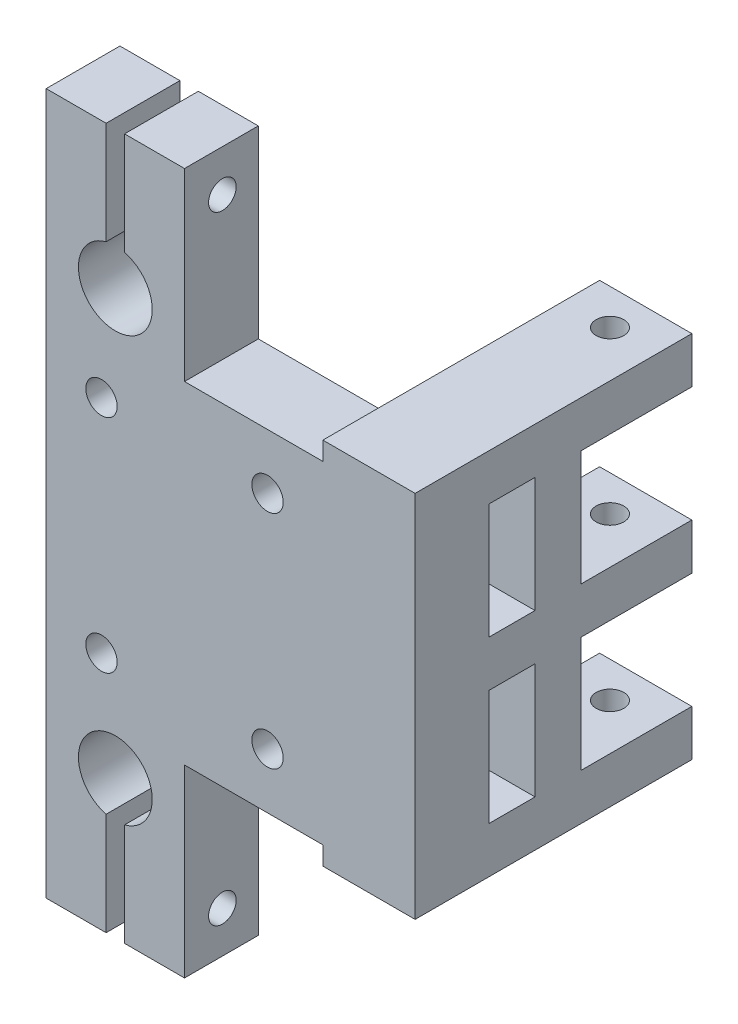
from build123d import *

# Parameters (mm, degrees)
SKETCH_1_W          = 30
SKETCH_1_H          = 36
SKETCH_1_R          = 1.7
EXTRUDE_1_DEPTH     = 8
SKETCH_2_R          = 3.75
CUT_EXTRUDE_1_DEPTH = 4.5
SKETCH_3_W          = 15
SKETCH_3_H          = 20
SKETCH_3_R          = 4
EXTRUDE_4_DEPTH     = 8
SKETCH_8_W          = 10
SKETCH_8_H          = 40
EXTRUDE_5_DEPTH     = 30
SKETCH_10_W         = 12
SKETCH_10_H         = 12.5
SKETCH_10_W_2       = 5
CUT_EXTRUDE_4_DEPTH = 30
SKETCH_11_R         = 1.5
CUT_EXTRUDE_5_DEPTH = 47
SKETCH_12_W         = 2
SKETCH_12_H         = 25.842259392
SKETCH_12_H_2       = 30.756424204
CUT_EXTRUDE_6_DEPTH = 10
SKETCH_13_R         = 1.5
CUT_EXTRUDE_7_DEPTH = 40


with BuildPart() as part:
    # 草图1 → 凸台-拉伸1 (new body)
    with BuildSketch(Plane.XY):
        with Locations((-3.375, -1.625)):
            Rectangle(SKETCH_1_W, SKETCH_1_H)
        with Locations((-12.375, 10.375)):
            Circle(SKETCH_1_R, mode=Mode.SUBTRACT)
        with Locations((-12.375, -13.625)):
            Circle(SKETCH_1_R, mode=Mode.SUBTRACT)
        with Locations(Location((5.625, -13.625, 0), (0, 0, 180))):
            Circle(SKETCH_1_R, mode=Mode.SUBTRACT)
        with Locations(Location((5.625, 10.375, 0), (0, 0, 180))):
            Circle(SKETCH_1_R, mode=Mode.SUBTRACT)
    extrude(amount=EXTRUDE_1_DEPTH)

    # 草图2 → 切除-拉伸1 (cut)
    with BuildSketch(Plane(origin=(0, 0, 0), x_dir=(-1, 0, 0), z_dir=(0, 0, -1))):
        with Locations((12.375, 10.375)):
            Circle(SKETCH_2_R)
        with Locations(Location((-5.625, 10.375, 0), (0, 0, 180))):
            Circle(SKETCH_2_R)
        with Locations(Location((12.375, -13.625, 0), (0, 0, 180))):
            Circle(SKETCH_2_R)
        with Locations((-5.625, -13.625)):
            Circle(SKETCH_2_R)
    extrude(amount=-CUT_EXTRUDE_1_DEPTH, mode=Mode.SUBTRACT)

    # 草图3 → 凸台-拉伸4 (add)
    # profile 1 of 2: a face of its own
    with BuildSketch(Plane.XY.offset(8)):
        with Locations((-10.875, 26.375)):
            Rectangle(SKETCH_3_W, SKETCH_3_H)
        with Locations((-10.875, 21.375)):
            Circle(SKETCH_3_R, mode=Mode.SUBTRACT)
    # profile 2 of 2: a face of its own
    with BuildSketch(Plane.XY.offset(8)):
        with Locations((-10.875, -29.625)):
            Rectangle(SKETCH_3_W, SKETCH_3_H)
        with Locations((-10.875, -24.625)):
            Circle(SKETCH_3_R, mode=Mode.SUBTRACT)
    extrude(amount=-EXTRUDE_4_DEPTH)

    # 草图8 → 凸台-拉伸5 (add)
    with BuildSketch(Plane.XY.offset(8)):
        with Locations((16.625, -1.625)):
            Rectangle(SKETCH_8_W, SKETCH_8_H)
    extrude(amount=-EXTRUDE_5_DEPTH)

    # 草图10 → 切除-拉伸4 (cut)
    with BuildSketch(Plane.ZY.offset(-11.625)):
        with Locations((-16, 7.125)):
            Rectangle(SKETCH_10_W, SKETCH_10_H)
        with Locations((-2.5, 7.125)):
            Rectangle(SKETCH_10_W_2, SKETCH_10_H)
        with Locations((-2.5, -10.375)):
            Rectangle(SKETCH_10_W_2, SKETCH_10_H)
        with Locations((-16, -10.375)):
            Rectangle(SKETCH_10_W, SKETCH_10_H)
    extrude(amount=-CUT_EXTRUDE_4_DEPTH, mode=Mode.SUBTRACT)

    # 草图11 → 切除-拉伸5 (cut)
    with BuildSketch(Plane(origin=(0, 18.375, 0), x_dir=(1, 0, 0), z_dir=(0, 1, 0))):
        with Locations(Location((16.621809271, 18.123313308, 0), (0, 0, 180))):
            Circle(SKETCH_11_R)
    extrude(amount=-CUT_EXTRUDE_5_DEPTH, mode=Mode.SUBTRACT)

    # 草图12 → 切除-拉伸6 (cut)
    with BuildSketch(Plane(origin=(0, 0, 0), x_dir=(-1, 0, 0), z_dir=(0, 0, -1))):
        with Locations((10.875, 36.375)):
            Rectangle(SKETCH_12_W, SKETCH_12_H)
        with Locations((10.875, -39.625)):
            Rectangle(SKETCH_12_W, SKETCH_12_H_2)
    extrude(amount=-CUT_EXTRUDE_6_DEPTH, mode=Mode.SUBTRACT)

    # 草图13 → 切除-拉伸7 (cut)
    with BuildSketch(Plane.ZY.offset(18.375)):
        with Locations((3.892451488, 31.868119268)):
            Circle(SKETCH_13_R)
        with Locations(Location((3.892451488, -35.118119268, 0), (0, 0, 270))):
            Circle(SKETCH_13_R)
    extrude(amount=-CUT_EXTRUDE_7_DEPTH, mode=Mode.SUBTRACT)


solid = part.part
